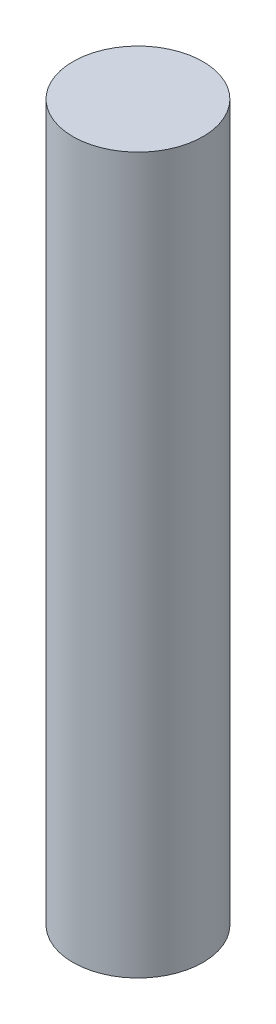
from build123d import *

# Parameters (mm, degrees)
SKETCH8_R           = 5
BOSS_EXTRUDE2_DEPTH = 55


with BuildPart() as part:
    # Sketch8 → Boss-Extrude2 (new body)
    with BuildSketch(Plane(origin=(0, 0, 0), x_dir=(1, 0, 0), z_dir=(0, 1, 0))):
        with Locations(Location((0, 0, 0), (0, 0, 270))):
            Circle(SKETCH8_R)
    extrude(amount=BOSS_EXTRUDE2_DEPTH)


solid = part.part
